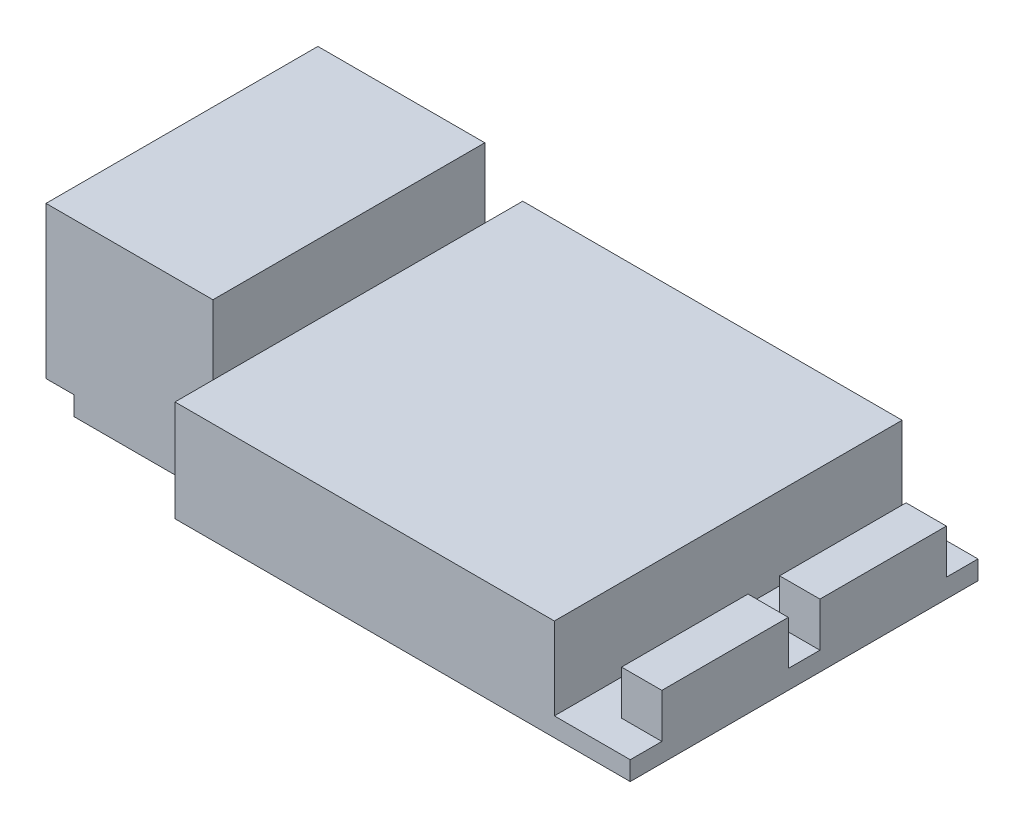
from build123d import *

# Parameters (mm, degrees)
EXTRUDE_1_DEPTH = 1.5
SKETCH_2_W      = 30
SKETCH_2_H      = 27.5
EXTRUDE_2_DEPTH = 6.5
SKETCH_3_W      = 13.2
SKETCH_3_H      = 21.5
EXTRUDE_3_DEPTH = 12
SKETCH_4_W      = 3.188486523
SKETCH_4_H      = 10
EXTRUDE_4_DEPTH = 3.5


with BuildPart() as part:
    # 草图1 → 凸台-拉伸1 (new body)
    with BuildSketch(Plane(origin=(0, 0, 0), x_dir=(1, 0, 0), z_dir=(0, 1, 0))):
        Polygon((-23.5, 10.75), (-12.5, 10.75), (-12.5, 13.75), (23.5, 13.75), (23.5, -13.75), (-12.5, -13.75), (-12.5, -10.75), (-23.5, -10.75), align=None)
    extrude(amount=EXTRUDE_1_DEPTH)

    # 草图2 → 凸台-拉伸2 (add)
    with BuildSketch(Plane(origin=(0, 1.5, 0), x_dir=(1, 0, 0), z_dir=(0, 1, 0))):
        with Locations((2.5, 0)):
            Rectangle(SKETCH_2_W, SKETCH_2_H)
    extrude(amount=EXTRUDE_2_DEPTH)

    # 草图3 → 凸台-拉伸3 (add)
    with BuildSketch(Plane(origin=(0, 1.5, 0), x_dir=(1, 0, 0), z_dir=(0, 1, 0))):
        with Locations((-19.1, 0)):
            Rectangle(SKETCH_3_W, SKETCH_3_H)
    extrude(amount=EXTRUDE_3_DEPTH)

    # 草图4 → 凸台-拉伸4 (add)
    with BuildSketch(Plane(origin=(0, 1.5, 0), x_dir=(1, 0, 0), z_dir=(0, 1, 0))):
        with Locations((21.905756739, 6.25)):
            Rectangle(SKETCH_4_W, SKETCH_4_H)
        with Locations((21.905756739, -6.25)):
            Rectangle(SKETCH_4_W, SKETCH_4_H)
    extrude(amount=EXTRUDE_4_DEPTH)


solid = part.part
